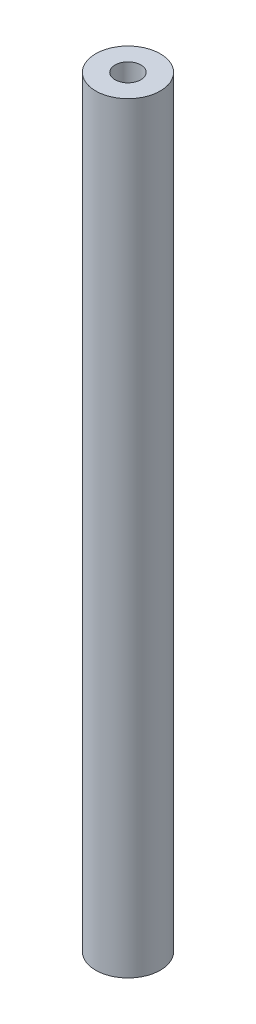
from build123d import *

# Parameters (mm, degrees)
SKETCH1_R           = 10
SKETCH1_R_2         = 4
BOSS_EXTRUDE1_DEPTH = 236


with BuildPart() as part:
    # Sketch1 → Boss-Extrude1 (new body)
    with BuildSketch(Plane(origin=(0, 0, 0), x_dir=(1, 0, 0), z_dir=(0, 1, 0))):
        with Locations(Location((0, 0, 0), (0, 0, 270))):
            Circle(SKETCH1_R)
        with Locations(Location((0, 0, 0), (0, 0, 270))):
            Circle(SKETCH1_R_2, mode=Mode.SUBTRACT)
    extrude(amount=BOSS_EXTRUDE1_DEPTH)


solid = part.part
